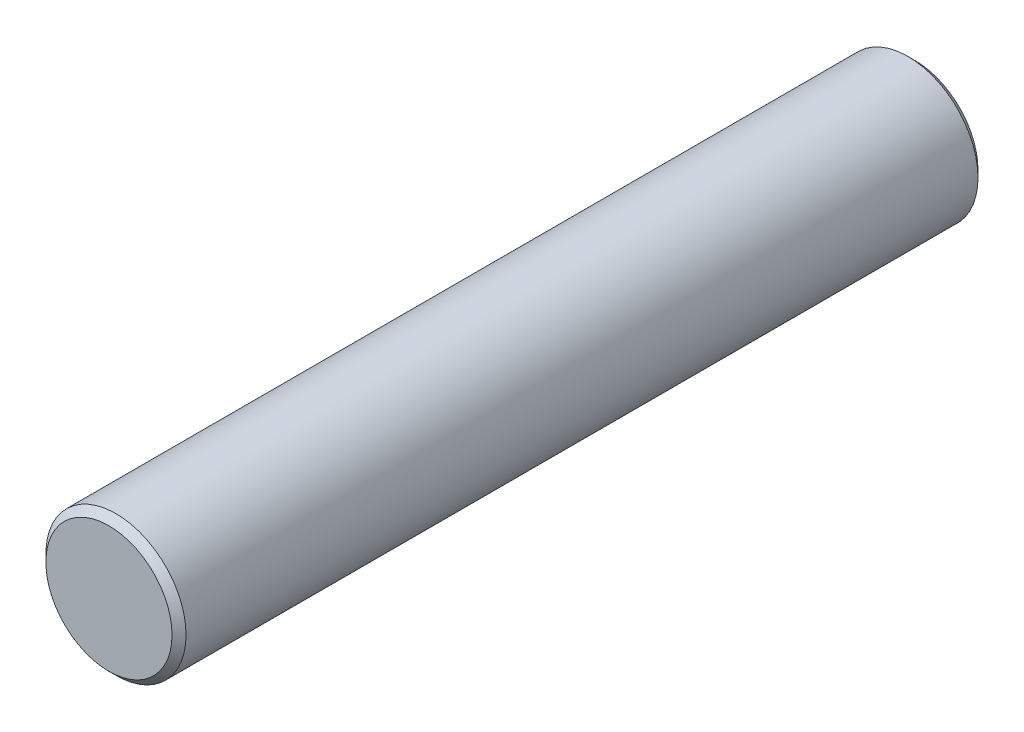
from build123d import *

# Parameters (mm, degrees)
SKETCH_1_R      = 2
EXTRUDE_1_DEPTH = 23
CHAMFER_1_SIZE  = 0.2


with BuildPart() as part:
    # 草图1 → 凸台-拉伸1 (new body)
    with BuildSketch(Plane.XY):
        Circle(SKETCH_1_R)
    extrude(amount=EXTRUDE_1_DEPTH)

    # 倒角1
    chamfer_1_edges = [part.edges().sort_by_distance(p)[0] for p in [
        (-2, 0, 0),
        (-2, 0, 23),
    ]]
    chamfer(chamfer_1_edges, length=CHAMFER_1_SIZE)


solid = part.part
